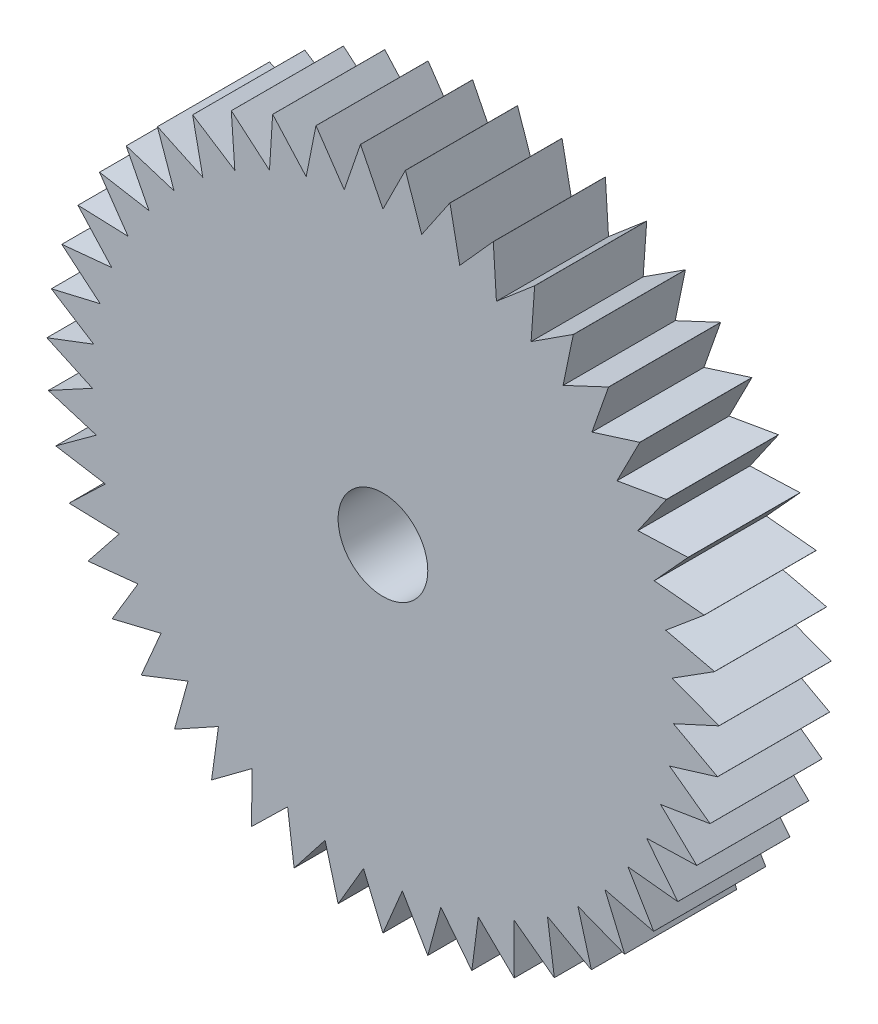
from build123d import *

# Parameters (mm, degrees)
CROQUIS2_R              = 15
CROQUIS2_R_2            = 2
SALIENTE_EXTRUIR1_DEPTH = 5
CORTAR_EXTRUIR2_START   = -5
CORTAR_EXTRUIR2_DEPTH   = 5


with BuildPart() as part:
    # Croquis2 → Saliente-Extruir1 (new body)
    with BuildSketch(Plane.XY):
        Circle(CROQUIS2_R)
        Circle(CROQUIS2_R_2, mode=Mode.SUBTRACT)
    extrude(amount=SALIENTE_EXTRUIR1_DEPTH)

    # Croquis3 → Cortar-Extruir2 (cut)
    with BuildSketch(Plane.XY.offset(5).offset(CORTAR_EXTRUIR2_START)):
        with BuildLine():
            Line((-1, 14.966629547), (0, 12.966629547))
            Line((0, 12.966629547), (1, 14.966629547))
            ThreePointArc((1, 14.966629547), (0, 15), (-1, 14.966629547))
        make_face()
        with BuildLine():
            Line((1.003778996, 14.966376573), (1.728282574, 12.850934641))
            Line((1.728282574, 12.850934641), (2.985933973, 14.699802662))
            ThreePointArc((2.985933973, 14.699802662), (1.999304331, 14.866162322), (1.003778996, 14.966376573))
        make_face()
        with BuildLine():
            Line((2.989645533, 14.699048255), (3.425723904, 12.505914503))
            Line((3.425723904, 12.505914503), (4.918583883, 14.170657451))
            ThreePointArc((4.918583883, 14.170657451), (3.962931028, 14.467037626), (2.989645533, 14.699048255))
        make_face()
        with BuildLine():
            Line((4.922161774, 14.169415072), (5.06203311, 11.937726023))
            Line((5.06203311, 11.937726023), (6.763461547, 13.388636521))
            ThreePointArc((6.763461547, 13.388636521), (5.855839127, 13.8097483), (4.922161774, 14.169415072))
        make_face()
        with BuildLine():
            Line((6.766841921, 13.386928341), (6.608010216, 11.15650854))
            Line((6.608010216, 11.15650854), (8.48764508, 12.367695056))
            ThreePointArc((8.48764508, 12.367695056), (7.644249639, 12.906023689), (6.766841921, 13.386928341))
        make_face()
        with BuildLine():
            Line((8.490767615, 12.365551557), (8.036067222, 10.176202898))
            Line((8.036067222, 10.176202898), (10.060366385, 11.126051779))
            ThreePointArc((10.060366385, 11.126051779), (9.296248334, 11.771990779), (8.490767615, 12.365551557))
        make_face()
        with BuildLine():
            Line((10.063175359, 11.123511213), (9.320720419, 9.014302674))
            Line((9.320720419, 9.014302674), (11.453560214, 9.685863845))
            ThreePointArc((11.453560214, 9.685863845), (10.782355258, 10.427886415), (10.063175359, 11.123511213))
        make_face()
        with BuildLine():
            Line((11.4560055, 9.682971547), (10.439045138, 7.691542005))
            Line((10.439045138, 7.691542005), (12.642364989, 8.072831441))
            ThreePointArc((12.642364989, 8.072831441), (12.076050797, 8.897696171), (11.4560055, 9.682971547))
        make_face()
        with BuildLine():
            Line((12.644402952, 8.069639025), (11.37108485, 6.231525587))
            Line((11.37108485, 6.231525587), (13.605566462, 6.315739169))
            ThreePointArc((13.605566462, 6.315739169), (13.154248923, 7.208726328), (12.644402952, 8.069639025))
        make_face()
        with BuildLine():
            Line((13.607160733, 6.312303603), (12.100207284, 4.660307447))
            Line((12.100207284, 4.660307447), (14.325976279, 4.445942381))
            ThreePointArc((14.325976279, 4.445942381), (13.997709166, 5.391116593), (13.607160733, 6.312303603))
        make_face()
        with BuildLine():
            Line((14.327098409, 4.442324974), (12.613401232, 3.00592601))
            Line((12.613401232, 3.00592601), (14.79073871, 2.496807647))
            ThreePointArc((14.79073871, 2.496807647), (14.591379956, 3.477302254), (14.327098409, 4.442324974))
        make_face()
        with BuildLine():
            Line((14.791368674, 2.493072951), (12.901508736, 1.297903753))
            Line((12.901508736, 1.297903753), (14.991560058, 0.503117321))
            ThreePointArc((14.991560058, 0.503117321), (14.924667226, 1.501435374), (14.791368674, 2.493072951))
        make_face()
        with BuildLine():
            Line((14.991686615, 0.499331982), (12.959388511, -0.433279628))
            Line((12.959388511, -0.433279628), (14.924856661, -1.499551146))
            ThreePointArc((14.924856661, -1.499551146), (14.991623456, -0.501224655), (14.991686615, 0.499331982))
        make_face()
        with BuildLine():
            Line((14.924477553, -1.503319579), (12.786007691, -2.156731124))
            Line((12.786007691, -2.156731124), (14.591818844, -3.475460087))
            ThreePointArc((14.591818844, -3.475460087), (14.79105381, -2.494940319), (14.924477553, -1.503319579))
        make_face()
        with BuildLine():
            Line((14.590940836, -3.479144366), (12.384460261, -3.841695701))
            Line((12.384460261, -3.841695701), (13.998389674, -5.38934936))
            ThreePointArc((13.998389674, -5.38934936), (14.326537458, -4.444133713), (14.590940836, -3.479144366))
        make_face()
        with BuildLine():
            Line((13.997028434, -5.392883739), (11.761911844, -5.458105128))
            Line((11.761911844, -5.458105128), (13.155158909, -7.207065566))
            ThreePointArc((13.155158909, -7.207065566), (13.606363706, -6.314021436), (13.997028434, -5.392883739))
        make_face()
        with BuildLine():
            Line((13.153338728, -7.210386974), (10.929471832, -6.977114539))
            Line((10.929471832, -6.977114539), (12.077174021, -8.896171517))
            ThreePointArc((12.077174021, -8.896171517), (12.643384071, -8.071235297), (13.153338728, -7.210386974))
        make_face()
        with BuildLine():
            Line((12.07492738, -8.899220683), (9.901995135, -8.371617176))
            Line((9.901995135, -8.371617176), (10.783671677, -10.426525076))
            ThreePointArc((10.783671677, -10.426525076), (11.454782948, -9.684417773), (12.07492738, -8.899220683))
        make_face()
        with BuildLine():
            Line((10.781038667, -10.429247588), (8.697817102, -9.616728107))
            Line((8.697817102, -9.616728107), (9.297734456, -11.770817048))
            ThreePointArc((9.297734456, -11.770817048), (10.061770952, -11.124781585), (10.781038667, -10.429247588))
        make_face()
        with BuildLine():
            Line((9.294762064, -11.773164323), (7.338426315, -10.690228296))
            Line((7.338426315, -10.690228296), (7.645878944, -12.905058511))
            ThreePointArc((7.645878944, -12.905058511), (8.489206415, -12.366623405), (9.294762064, -11.773164323))
        make_face()
        with BuildLine():
            Line((7.642620212, -12.906988661), (5.848081138, -11.572961108))
            Line((5.848081138, -11.572961108), (5.85758254, -13.809008899))
            ThreePointArc((5.85758254, -13.809008899), (6.765151788, -13.387782538), (7.642620212, -12.906988661))
        make_face()
        with BuildLine():
            Line((5.854095621, -13.810487481), (4.253376814, -12.249174155))
            Line((4.253376814, -12.249174155), (3.964757438, -14.466537197))
            ThreePointArc((3.964757438, -14.466537197), (4.920372868, -14.170036374), (5.854095621, -13.810487481))
        make_face()
        with BuildLine():
            Line((3.961104555, -14.467537825), (2.58277088, -12.7068004))
            Line((2.58277088, -12.7068004), (2.001181145, -14.865909795))
            ThreePointArc((2.001181145, -14.865909795), (2.987789777, -14.699425576), (3.961104555, -14.467537825))
        make_face()
        with BuildLine():
            Line((1.997427484, -14.866414613), (0.866075338, -12.937673489))
            Line((0.866075338, -12.937673489), (0.001893727, -14.99999988))
            ThreePointArc((0.001893727, -14.99999988), (1.001889506, -14.966503179), (1.997427484, -14.866414613))
        make_face()
        with BuildLine():
            Line((-0.001893727, -14.99999988), (-0.866075338, -12.937673489))
            Line((-0.866075338, -12.937673489), (-1.997427484, -14.866414613))
            ThreePointArc((-1.997427484, -14.866414613), (-1.001889506, -14.966503179), (-0.001893727, -14.99999988))
        make_face()
        with BuildLine():
            Line((-2.001181145, -14.865909795), (-2.58277088, -12.7068004))
            Line((-2.58277088, -12.7068004), (-3.961104555, -14.467537825))
            ThreePointArc((-3.961104555, -14.467537825), (-2.987789777, -14.699425576), (-2.001181145, -14.865909795))
        make_face()
        with BuildLine():
            Line((-3.964757438, -14.466537197), (-4.253376814, -12.249174155))
            Line((-4.253376814, -12.249174155), (-5.854095621, -13.810487481))
            ThreePointArc((-5.854095621, -13.810487481), (-4.920372868, -14.170036374), (-3.964757438, -14.466537197))
        make_face()
        with BuildLine():
            Line((-5.85758254, -13.809008899), (-5.848081138, -11.572961108))
            Line((-5.848081138, -11.572961108), (-7.642620212, -12.906988661))
            ThreePointArc((-7.642620212, -12.906988661), (-6.765151788, -13.387782538), (-5.85758254, -13.809008899))
        make_face()
        with BuildLine():
            Line((-7.645878944, -12.905058511), (-7.338426315, -10.690228296))
            Line((-7.338426315, -10.690228296), (-9.294762064, -11.773164323))
            ThreePointArc((-9.294762064, -11.773164323), (-8.489206415, -12.366623405), (-7.645878944, -12.905058511))
        make_face()
        with BuildLine():
            Line((-9.297734456, -11.770817048), (-8.697817102, -9.616728107))
            Line((-8.697817102, -9.616728107), (-10.781038667, -10.429247588))
            ThreePointArc((-10.781038667, -10.429247588), (-10.061770952, -11.124781585), (-9.297734456, -11.770817048))
        make_face()
        with BuildLine():
            Line((-10.783671677, -10.426525076), (-9.901995135, -8.371617176))
            Line((-9.901995135, -8.371617176), (-12.07492738, -8.899220683))
            ThreePointArc((-12.07492738, -8.899220683), (-11.454782948, -9.684417773), (-10.783671677, -10.426525076))
        make_face()
        with BuildLine():
            Line((-12.077174021, -8.896171517), (-10.929471832, -6.977114539))
            Line((-10.929471832, -6.977114539), (-13.153338728, -7.210386974))
            ThreePointArc((-13.153338728, -7.210386974), (-12.643384071, -8.071235297), (-12.077174021, -8.896171517))
        make_face()
        with BuildLine():
            Line((-13.155158909, -7.207065566), (-11.761911844, -5.458105128))
            Line((-11.761911844, -5.458105128), (-13.997028434, -5.392883739))
            ThreePointArc((-13.997028434, -5.392883739), (-13.606363706, -6.314021436), (-13.155158909, -7.207065566))
        make_face()
        with BuildLine():
            Line((-13.998389674, -5.38934936), (-12.384460261, -3.841695701))
            Line((-12.384460261, -3.841695701), (-14.590940836, -3.479144366))
            ThreePointArc((-14.590940836, -3.479144366), (-14.326537458, -4.444133713), (-13.998389674, -5.38934936))
        make_face()
        with BuildLine():
            Line((-14.591818844, -3.475460087), (-12.786007691, -2.156731124))
            Line((-12.786007691, -2.156731124), (-14.924477553, -1.503319579))
            ThreePointArc((-14.924477553, -1.503319579), (-14.79105381, -2.494940319), (-14.591818844, -3.475460087))
        make_face()
        with BuildLine():
            Line((-14.924856661, -1.499551146), (-12.959388511, -0.433279628))
            Line((-12.959388511, -0.433279628), (-14.991686615, 0.499331982))
            ThreePointArc((-14.991686615, 0.499331982), (-14.991623456, -0.501224655), (-14.924856661, -1.499551146))
        make_face()
        with BuildLine():
            Line((-14.991560058, 0.503117321), (-12.901508736, 1.297903753))
            Line((-12.901508736, 1.297903753), (-14.791368674, 2.493072951))
            ThreePointArc((-14.791368674, 2.493072951), (-14.924667226, 1.501435374), (-14.991560058, 0.503117321))
        make_face()
        with BuildLine():
            Line((-14.79073871, 2.496807647), (-12.613401232, 3.00592601))
            Line((-12.613401232, 3.00592601), (-14.327098409, 4.442324974))
            ThreePointArc((-14.327098409, 4.442324974), (-14.591379956, 3.477302254), (-14.79073871, 2.496807647))
        make_face()
        with BuildLine():
            Line((-14.325976279, 4.445942381), (-12.100207284, 4.660307447))
            Line((-12.100207284, 4.660307447), (-13.607160733, 6.312303603))
            ThreePointArc((-13.607160733, 6.312303603), (-13.997709166, 5.391116593), (-14.325976279, 4.445942381))
        make_face()
        with BuildLine():
            Line((-13.605566462, 6.315739169), (-11.37108485, 6.231525587))
            Line((-11.37108485, 6.231525587), (-12.644402952, 8.069639025))
            ThreePointArc((-12.644402952, 8.069639025), (-13.154248923, 7.208726328), (-13.605566462, 6.315739169))
        make_face()
        with BuildLine():
            Line((-12.642364989, 8.072831441), (-10.439045138, 7.691542005))
            Line((-10.439045138, 7.691542005), (-11.4560055, 9.682971547))
            ThreePointArc((-11.4560055, 9.682971547), (-12.076050797, 8.897696171), (-12.642364989, 8.072831441))
        make_face()
        with BuildLine():
            Line((-11.453560214, 9.685863845), (-9.320720419, 9.014302674))
            Line((-9.320720419, 9.014302674), (-10.063175359, 11.123511213))
            ThreePointArc((-10.063175359, 11.123511213), (-10.782355258, 10.427886415), (-11.453560214, 9.685863845))
        make_face()
        with BuildLine():
            Line((-10.060366385, 11.126051779), (-8.036067222, 10.176202898))
            Line((-8.036067222, 10.176202898), (-8.490767615, 12.365551557))
            ThreePointArc((-8.490767615, 12.365551557), (-9.296248334, 11.771990779), (-10.060366385, 11.126051779))
        make_face()
        with BuildLine():
            Line((-8.48764508, 12.367695056), (-6.608010216, 11.15650854))
            Line((-6.608010216, 11.15650854), (-6.766841921, 13.386928341))
            ThreePointArc((-6.766841921, 13.386928341), (-7.644249639, 12.906023689), (-8.48764508, 12.367695056))
        make_face()
        with BuildLine():
            Line((-6.763461547, 13.388636521), (-5.06203311, 11.937726023))
            Line((-5.06203311, 11.937726023), (-4.922161774, 14.169415072))
            ThreePointArc((-4.922161774, 14.169415072), (-5.855839127, 13.8097483), (-6.763461547, 13.388636521))
        make_face()
        with BuildLine():
            Line((-4.918583883, 14.170657451), (-3.425723904, 12.505914503))
            Line((-3.425723904, 12.505914503), (-2.989645533, 14.699048255))
            ThreePointArc((-2.989645533, 14.699048255), (-3.962931028, 14.467037626), (-4.918583883, 14.170657451))
        make_face()
        with BuildLine():
            Line((-2.985933973, 14.699802662), (-1.728282574, 12.850934641))
            Line((-1.728282574, 12.850934641), (-1.003778996, 14.966376573))
            ThreePointArc((-1.003778996, 14.966376573), (-1.999304331, 14.866162322), (-2.985933973, 14.699802662))
        make_face()
    extrude(amount=CORTAR_EXTRUIR2_DEPTH, mode=Mode.SUBTRACT)


solid = part.part
